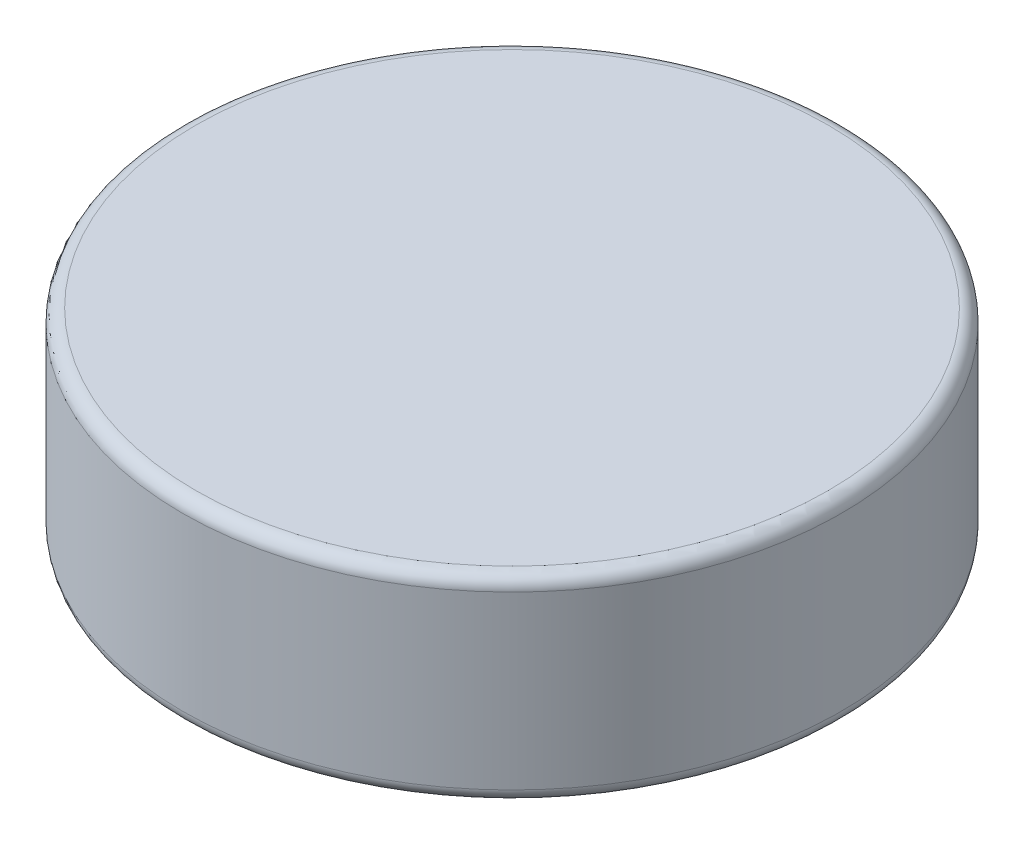
from build123d import *

# Parameters (mm, degrees)
SKETCH1_R           = 50
BOSS_EXTRUDE1_DEPTH = 15
FILLET1_R           = 2


with BuildPart() as part:
    # Sketch1 → Boss-Extrude1 (new, symmetric)
    with BuildSketch(Plane(origin=(0, 0, 0), x_dir=(1, 0, 0), z_dir=(0, 1, 0))):
        with Locations(Location((0, 0, 0), (0, 0, 270))):
            Circle(SKETCH1_R)
    extrude(amount=BOSS_EXTRUDE1_DEPTH, both=True)

    # Fillet1
    fillet1_edges = [part.edges().sort_by_distance(p)[0] for p in [
        (0, -15, -50),
        (0, 15, -50),
    ]]
    fillet(fillet1_edges, radius=FILLET1_R)


solid = part.part
